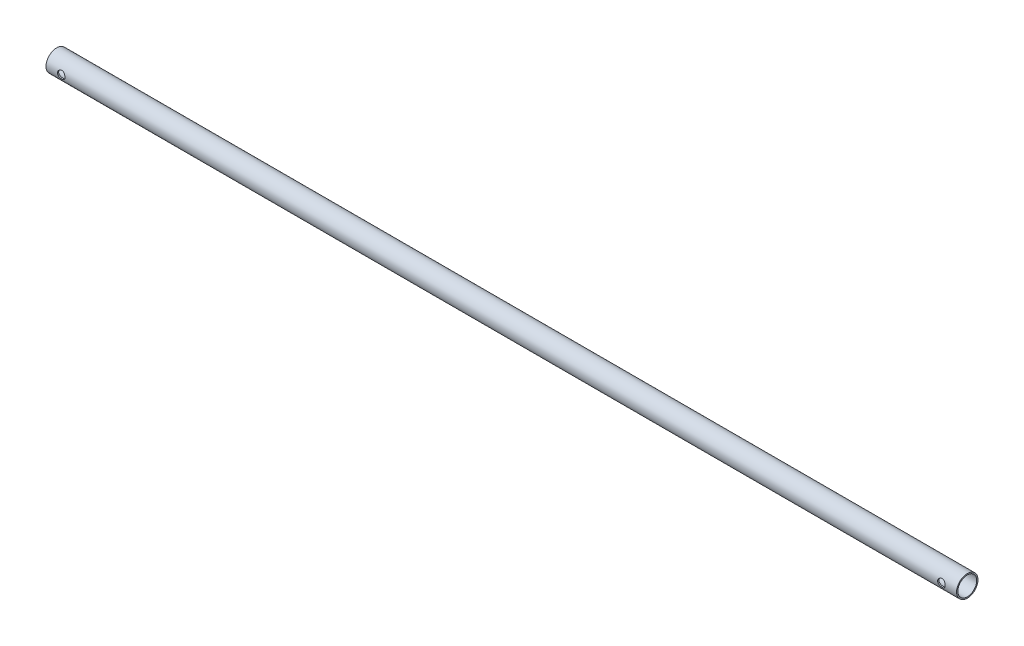
from build123d import *

# Parameters (mm, degrees)
SKETCH1_R               = 8.9662
SKETCH1_R_2             = 7.8994
BOSS_EXTRUDE1_DEPTH     = 762
CUT_EXTRUDE1_DEPTH      = 763.105494984
CUT_EXTRUDE1_DEPTH_BACK = 763.105494984
SKETCH2_R               = 3.175


with BuildPart() as part:
    # Sketch1 → Boss-Extrude1 (new body)
    with BuildSketch(Plane(origin=(0, 0, 0), x_dir=(0, 0, -1), z_dir=(1, 0, 0))):
        Circle(SKETCH1_R)
        Circle(SKETCH1_R_2, mode=Mode.SUBTRACT)
    extrude(amount=BOSS_EXTRUDE1_DEPTH)

    # Sketch2 → Cut-Extrude1 (cut, two sides: drawn at the far end of the back side and taken through both)
    with BuildSketch(Plane.XY.offset(-CUT_EXTRUDE1_DEPTH_BACK)):
        with Locations((749.3, 0)):
            Circle(SKETCH2_R)
        with Locations((12.7, 0)):
            Circle(SKETCH2_R)
    extrude(amount=CUT_EXTRUDE1_DEPTH + CUT_EXTRUDE1_DEPTH_BACK, mode=Mode.SUBTRACT)


solid = part.part
